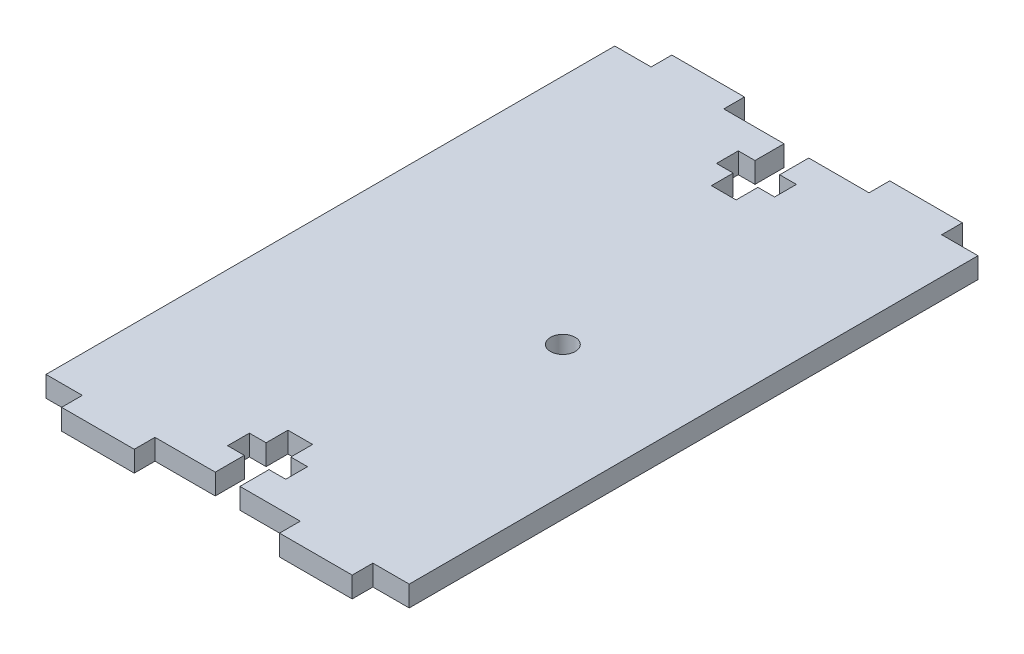
from build123d import *

# Parameters (mm, degrees)
SKETCH1_W           = 50
SKETCH1_H           = 78.3
BOSS_EXTRUDE1_DEPTH = 2.85
SKETCH2_R           = 1.7
CUT_EXTRUDE1_DEPTH  = 47.53863986
CUT_EXTRUDE2_DEPTH  = 47.53863986
SKETCH4_W           = 10
SKETCH4_H           = 2.85
BOSS_EXTRUDE2_DEPTH = 2.85


with BuildPart() as part:
    # Sketch1 → Boss-Extrude1 (new body)
    with BuildSketch(Plane(origin=(0, 0, 0), x_dir=(1, 0, 0), z_dir=(0, 1, 0))):
        Rectangle(SKETCH1_W, SKETCH1_H)
    extrude(amount=BOSS_EXTRUDE1_DEPTH)

    # Sketch2 → Cut-Extrude1 (cut, through all)
    with BuildSketch(Plane(origin=(0, 2.85, 0), x_dir=(1, 0, 0), z_dir=(0, 1, 0))):
        with Locations(Location((7, 0, 0), (0, 0, 270))):
            Circle(SKETCH2_R)
    extrude(amount=-CUT_EXTRUDE1_DEPTH, mode=Mode.SUBTRACT)

    # Sketch3 → Cut-Extrude2 (cut, through all)
    with BuildSketch(Plane(origin=(0, 2.85, 0), x_dir=(1, 0, 0), z_dir=(0, 1, 0))):
        Polygon((-4, 35.15), (-1.7, 35.15), (-1.7, 39.15), (1.7, 39.15), (1.7, 35.15), (4, 35.15), (4, 32.15), (1.7, 32.15), (1.7, 29.15), (-1.7, 29.15), (-1.7, 32.15), (-4, 32.15), align=None)
    cut_extrude2 = extrude(amount=-CUT_EXTRUDE2_DEPTH, mode=Mode.SUBTRACT)

    # Sketch4 → Boss-Extrude2 (add)
    with BuildSketch(Plane(origin=(0, 2.85, 0), x_dir=(1, 0, 0), z_dir=(0, 1, 0))):
        with Locations((-15, 40.575)):
            Rectangle(SKETCH4_W, SKETCH4_H)
        with Locations((15, 40.575)):
            Rectangle(SKETCH4_W, SKETCH4_H)
    boss_extrude2 = extrude(amount=-BOSS_EXTRUDE2_DEPTH)

    # Mirror1: Cut-Extrude2, Boss-Extrude2 across plane
    add(cut_extrude2.mirror(Plane.XY), mode=Mode.SUBTRACT)
    add(boss_extrude2.mirror(Plane.XY))


solid = part.part
